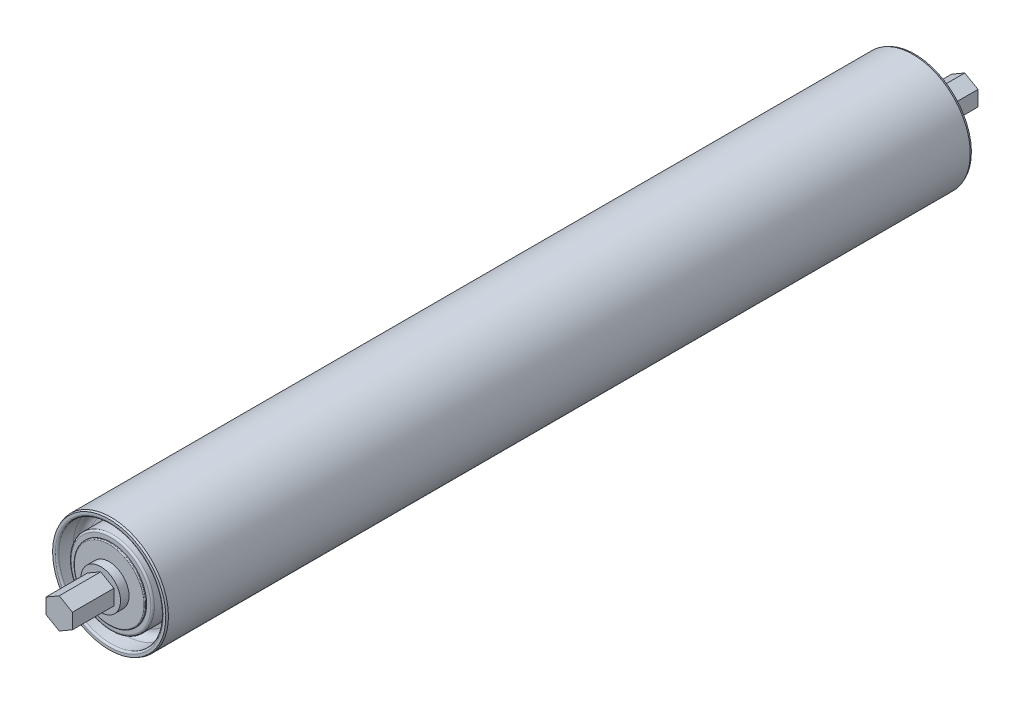
from build123d import *

# Parameters (mm, degrees)
BOSS_EXTRUDE1_REACH = 384.525


with BuildPart() as part:
    # Sketch3 → Revolve1 (revolve)
    with BuildSketch(Plane(origin=(0, 0, 0), x_dir=(0, 0, -1), z_dir=(1, 0, 0)), mode=Mode.PRIVATE) as revolve1_sk:
        Polygon((190.5, 5.55625), (173.0375, 5.55625), (173.0375, 8.334375), (169.465625, 8.334375), (169.465625, 23.8125), (168.671875, 24.13), (-168.671875, 24.13), (-169.465625, 23.8125), (-169.465625, 8.334375), (-173.0375, 8.334375), (-173.0375, 5.55625), (-190.5, 5.55625), (-190.5, 0), (190.5, 0), align=None)
    revolve(revolve1_sk.sketch.rotate(Axis((0, 0, 190.5), (0, 0, -1)), 180), axis=Axis((0, 0, 190.5), (0, 0, -1)))

    # Boss-Extrude1: up to this face of the body (flat: up to its plane)
    boss_extrude1_end = Plane(part.part.faces().sort_by_distance((0, 0, -190.5))[0])
    # Sketch4 → Boss-Extrude1 (add, up to the picked face)
    with BuildSketch(Plane.XY.offset(190.5), mode=Mode.PRIVATE) as boss_extrude1_sk1:
        Polygon((0, 6.415804866), (-5.55625, 3.207902433), (-5.55625, -3.207902433), (0, -6.415804866), (5.55625, -3.207902433), (5.55625, 3.207902433), align=None)
    boss_extrude1_tool1 = split(extrude(boss_extrude1_sk1.sketch, amount=-BOSS_EXTRUDE1_REACH, mode=Mode.PRIVATE), bisect_by=boss_extrude1_end, keep=Keep.BOTH, mode=Mode.PRIVATE)
    add(boss_extrude1_tool1.solids().sort_by(Axis((0, 0, 190.5), (0, 0, -1)))[0])

    # Sketch6 → Cut-Revolve1 (revolve, cut)
    with BuildSketch(Plane(origin=(0, 0, 0), x_dir=(0, 0, -1), z_dir=(1, 0, 0)), mode=Mode.PRIVATE) as cut_revolve1_sk:
        with BuildLine():
            Line((-162.59175, 21.971), (-168.703625, 21.971))
            ThreePointArc((-168.703625, 21.971), (-169.242440367, 22.194184633), (-169.465625, 22.733))
            Line((-169.465625, 22.733), (-169.465625, 14.620875))
            ThreePointArc((-169.465625, 14.620875), (-169.354032684, 14.890282684), (-169.084625, 15.001875))
            Line((-169.084625, 15.001875), (-168.703625, 15.001875))
            Line((-168.703625, 15.001875), (-168.703625, 16.7401875))
            ThreePointArc((-168.703625, 16.7401875), (-168.480440367, 17.279002867), (-167.941625, 17.5021875))
            Line((-167.941625, 17.5021875), (-159.54375, 17.5021875))
            Line((-159.54375, 17.5021875), (-159.54375, 18.923))
            ThreePointArc((-159.54375, 18.923), (-160.436488531, 21.078261469), (-162.59175, 21.971))
        make_face()
    cut_revolve1 = revolve(cut_revolve1_sk.sketch.rotate(Axis((0, 0, 190.5), (0, 0, -1)), 180), axis=Axis((0, 0, 190.5), (0, 0, -1)), mode=Mode.SUBTRACT)

    # Mirror2: Cut-Revolve1 across plane
    add(cut_revolve1.mirror(Plane.XY), mode=Mode.SUBTRACT)


solid = part.part
